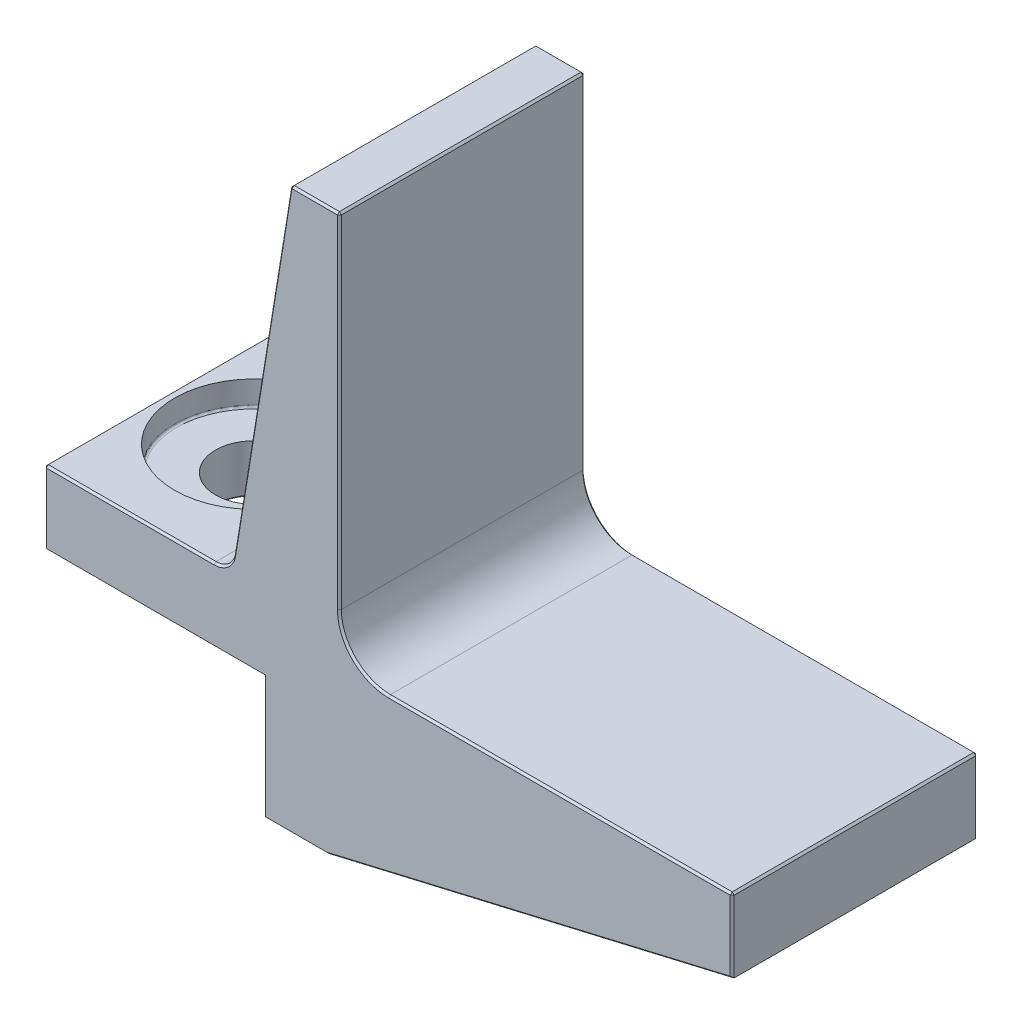
from build123d import *
from OCP.BRepFilletAPI import BRepFilletAPI_MakeChamfer

# Parameters (mm, degrees)
BOSS_EXTRUDE1_DEPTH                                  = 31.75
CBORE_FOR_3_8_BINDING_HEAD_MACHINE_SCREW_D           = 10.0838
CBORE_FOR_3_8_BINDING_HEAD_MACHINE_SCREW_CBORE_D     = 20.6756
CBORE_FOR_3_8_BINDING_HEAD_MACHINE_SCREW_CBORE_DEPTH = 3.175
FILLET1_R                                            = 2.54
FILLET2_R                                            = 6.35
CHAMFER1_SIZE                                        = 0.254
CHAMFER1_SIZE2                                       = 0.30739842
FILLET3_R                                            = 0.254
CHAMFER2_SIZE                                        = 0.254


with BuildPart() as part:
    # Sketch1 → Boss-Extrude1 (new body)
    with BuildSketch(Plane.XY):
        Polygon((0, 0), (50.8, 0), (50.8, -9.525), (-1.5848076, -21.771101892), (-9.8398076, -21.771101892), (-9.8398076, -5.896101892), (-38.1608076, -5.896101892), (-38.1608076, 3.628898108), (-14.0308076, 3.628898108), (-6.35, 50.8), (0, 50.8), align=None)
    extrude(amount=BOSS_EXTRUDE1_DEPTH)

    # CBORE for 3/8 Binding Head Machine Screw1 (through all)
    with Locations(Plane(origin=(0, 3.628898108, 0), x_dir=(1, 0, 0), z_dir=(0, 1, 0))):
        with Locations((-26.8578076, -15.875)):
            CounterBoreHole(CBORE_FOR_3_8_BINDING_HEAD_MACHINE_SCREW_D / 2, CBORE_FOR_3_8_BINDING_HEAD_MACHINE_SCREW_CBORE_D / 2, CBORE_FOR_3_8_BINDING_HEAD_MACHINE_SCREW_CBORE_DEPTH)

    # Fillet1
    fillet1_edges = [part.edges().sort_by_distance(p)[0] for p in [
        (-14.0308076, 3.628898108, 15.875),
    ]]
    fillet(fillet1_edges, radius=FILLET1_R)

    # Fillet2
    fillet2_edges = [part.edges().sort_by_distance(p)[0] for p in [
        (0, 0, 15.875),
    ]]
    fillet(fillet2_edges, radius=FILLET2_R)

    # Chamfer1: one chamfer whose edges measure the first distance from different faces: ONE call of the kernel's chamfer builder (chamfer() names one face for all edges)
    chamfer1_edges_1 = [part.edges().sort_by_distance(p)[0] for p in [
        (28.575, 0, 0),
        (50.8, -4.7625, 0),
        (24.6075962, -15.648050946, 0),
        (-5.7123076, -21.771101892, 0),
        (-9.8398076, -13.833601892, 0),
        (-10.016845438, 28.280344675, 31.75),
        (-24.0003076, -5.896101892, 0),
        (-38.1608076, -1.133601892, 0),
        (-10.016845438, 28.280344675, 0),
        (-3.175, 50.8, 0),
        (50.8, 0, 15.875),
        (-38.1608076, -5.896101892, 15.875),
        (-38.1608076, 3.628898108, 15.875),
        (0, 50.8, 15.875),
        (-38.1608076, -1.133601892, 31.75),
        (-24.0003076, -5.896101892, 31.75),
        (-9.8398076, -13.833601892, 31.75),
        (-5.7123076, -21.771101892, 31.75),
        (24.6075962, -15.648050946, 31.75),
        (50.8, -4.7625, 31.75),
        (-27.175740922, 3.628898108, 0),
        (-27.175740922, 3.628898108, 31.75),
        (-14.545263998, 4.233898076, 0),
        (-14.545263998, 4.233898076, 31.75),
        (28.575, 0, 31.75),
        (0, 28.575, 0),
        (0, 28.575, 31.75),
        (1.859871939, 1.859871939, 0),
        (1.859871939, 1.859871939, 31.75),
        (-3.175, 50.8, 31.75),
    ]]
    chamfer1_edges_2 = [part.edges().sort_by_distance(p)[0] for p in [
        (-6.35, 50.8, 15.875),
    ]]
    chamfer1_side_2 = [part.faces().sort_by_distance(p)[0] for p in [
        (-3.175, 50.8, 15.875),
    ]]
    chamfer1 = BRepFilletAPI_MakeChamfer(part.part.solid().wrapped)
    for e in chamfer1_edges_1:
        chamfer1.Add(CHAMFER1_SIZE, e.wrapped)
    for e in chamfer1_edges_2:
        chamfer1.Add(CHAMFER1_SIZE, CHAMFER1_SIZE2, e.wrapped, chamfer1_side_2[0].wrapped)  # the first distance lies on this face
    add(Compound.cast(chamfer1.Shape()), mode=Mode.REPLACE)

    # Fillet3
    fillet3_edges = [part.edges().sort_by_distance(p)[0] for p in [
        (-37.1956076, 0.453898108, 15.875),
    ]]
    fillet(fillet3_edges, radius=FILLET3_R)

    # Chamfer2
    chamfer2_edges = [part.edges().sort_by_distance(p)[0] for p in [
        (-21.8159076, -5.896101892, 15.875),
    ]]
    chamfer(chamfer2_edges, length=CHAMFER2_SIZE)


solid = part.part
